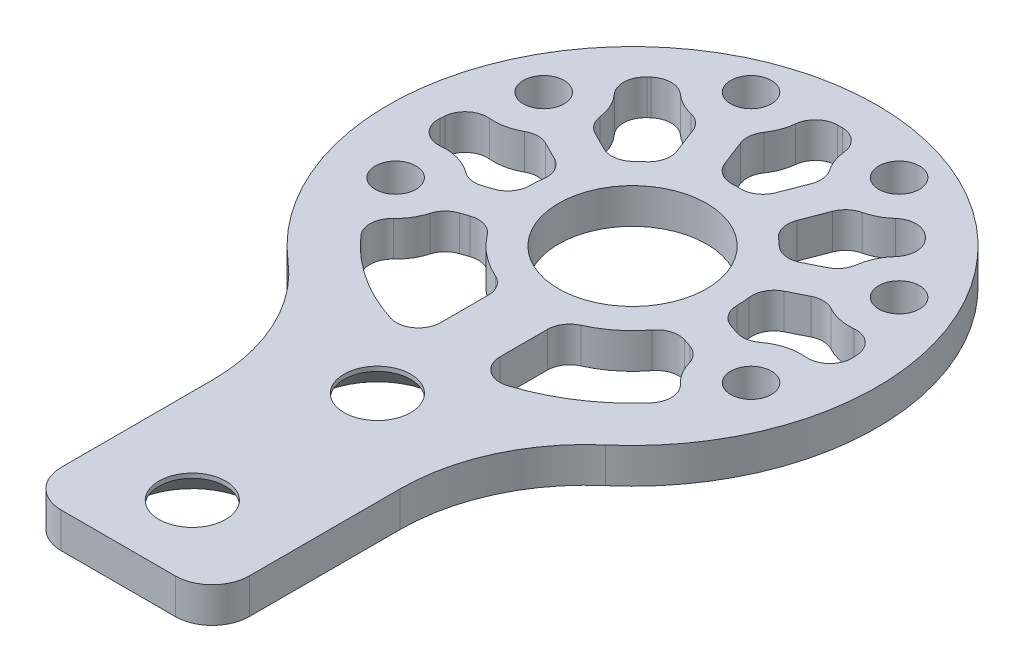
from build123d import *

# Parameters (mm, degrees)
BOSS_EXTRUDE1_DEPTH                            = 4.7625
SKETCH5_R                                      = 10
CUT_EXTRUDE1_DEPTH                             = 78.046358235
CSK_FOR_M8_FLAT_HEAD_MACHINE_SCREW1_AT_2_COUNT = 2
CSK_FOR_M8_FLAT_HEAD_MACHINE_SCREW1_AT_2_PITCH = 25
FILLET1_R                                      = 25
M5_CLEARANCE_HOLE1_D                           = 5.5
M5_CLEARANCE_HOLE1_CSINK_D                     = 5.55
M5_CLEARANCE_HOLE1_CSINK_ANGLE                 = 90
FILLET2_R                                      = 5
CUT_EXTRUDE2_DEPTH                             = 10
FILLET3_R                                      = 3


with BuildPart() as part:
    # Sketch1 → Boss-Extrude1 (new body)
    with BuildSketch(Plane(origin=(0, 0, 0), x_dir=(1, 0, 0), z_dir=(0, 1, 0))):
        with BuildLine():
            Line((-12.7, -69.458332193), (12.7, -69.458332193))
            Line((12.7, -69.458332193), (12.7, -30.458332193))
            ThreePointArc((12.7, -30.458332193), (0, 33), (-12.7, -30.458332193))
            Line((-12.7, -30.458332193), (-12.7, -69.458332193))
        make_face()
    extrude(amount=BOSS_EXTRUDE1_DEPTH)

    # Sketch5 → Cut-Extrude1 (cut, through all)
    with BuildSketch(Plane.XZ):
        with Locations(Location((0, 0, 0), (0, 0, 270))):
            Circle(SKETCH5_R)
    extrude(amount=-CUT_EXTRUDE1_DEPTH, mode=Mode.SUBTRACT)

    # Sketch8 → CSK for M8 Flat Head Machine Screw1 (revolve, cut)
    with BuildSketch(Plane(origin=(0, 0, 34.458332193), x_dir=(0, 0, -1), z_dir=(1, 0, 0))):
        Polygon((0, 0), (0, 4.7625), (4.5, 4.7625), (4.5, 4.15), (8.65, 0), align=None)
    csk_for_m8_flat_head_machine_screw1 = revolve(axis=Axis((0, -6.35, 34.458332193), (0, 1, 0)), mode=Mode.SUBTRACT)

    # CSK for M8 Flat Head Machine Screw1 at 2: CSK for M8 Flat Head Machine Screw1 ×2
    with Locations(*[(0, 0, i * CSK_FOR_M8_FLAT_HEAD_MACHINE_SCREW1_AT_2_PITCH) for i in range(1, CSK_FOR_M8_FLAT_HEAD_MACHINE_SCREW1_AT_2_COUNT)]):
        add(csk_for_m8_flat_head_machine_screw1, mode=Mode.SUBTRACT)

    # Fillet1
    fillet1_edges = [part.edges().sort_by_distance(p)[0] for p in [
        (-12.7, 2.38125, 30.458332193),
        (12.7, 2.38125, 30.458332193),
    ]]
    fillet(fillet1_edges, radius=FILLET1_R)

    # M5 Clearance Hole1 (through all)
    with Locations(Plane(origin=(0, 0, 0), x_dir=(-1, 0, 0), z_dir=(0, -1, 0))):
        with Locations((10, 26), (24, 12), (24, -8), (-10, 26), (-24, 12), (-24, -8)):
            CounterSinkHole(M5_CLEARANCE_HOLE1_D / 2, M5_CLEARANCE_HOLE1_CSINK_D / 2, counter_sink_angle=M5_CLEARANCE_HOLE1_CSINK_ANGLE)

    # Fillet2
    fillet2_edges = [part.edges().sort_by_distance(p)[0] for p in [
        (12.7, 2.38125, 69.458332193),
        (-12.7, 2.38125, 69.458332193),
    ]]
    fillet(fillet2_edges, radius=FILLET2_R)

    # Sketch12 → Cut-Extrude2 (cut)
    with BuildSketch(Plane(origin=(0, 4.7625, 0), x_dir=(1, 0, 0), z_dir=(0, 1, 0))):
        with BuildLine():
            ThreePointArc((-21.687002567, -14.341336048), (-14.041232428, -21.882499672), (-4, -25.690465157))
            Line((-4, -25.690465157), (-4, -13.416407865))
            ThreePointArc((-4, -13.416407865), (-8.799090908, -10.889260728), (-12.277521494, -6.727738548))
            Line((-12.277521494, -6.727738548), (-17.261216567, -8.388970239))
            ThreePointArc((-17.261216567, -8.388970239), (-18.583234462, -12.02754902), (-21.687002567, -14.341336048))
        make_face()
        with BuildLine():
            Line((4, -13.416407865), (4, -25.690465157))
            ThreePointArc((4, -25.690465157), (14.041232428, -21.882499672), (21.687002567, -14.341336048))
            ThreePointArc((21.687002567, -14.341336048), (18.583234462, -12.02754902), (17.261216567, -8.388970239))
            Line((17.261216567, -8.388970239), (12.277521494, -6.727738548))
            ThreePointArc((12.277521494, -6.727738548), (8.799090908, -10.889260728), (4, -13.416407865))
        make_face()
        with BuildLine():
            ThreePointArc((-27.322070756, 6.124087655), (-27.939323101, 1.842342162), (-27.889654363, -2.483380661))
            ThreePointArc((-27.889654363, -2.483380661), (-23.139993382, -1.305010185), (-18.842355397, -3.645553749))
            Line((-18.842355397, -3.645553749), (-13.858660324, -1.984322058))
            ThreePointArc((-13.858660324, -1.984322058), (-13.964778923, 0.992446281), (-13.438748254, 3.924289155))
            Line((-13.438748254, 3.924289155), (-19.510004032, 6.959917044))
            ThreePointArc((-19.510004032, 6.959917044), (-23.281901805, 5.288306102), (-27.322070756, 6.124087655))
        make_face()
        with BuildLine():
            ThreePointArc((18.842355397, -3.645553749), (23.139993382, -1.305010185), (27.889654363, -2.483380661))
            ThreePointArc((27.889654363, -2.483380661), (27.939323101, 1.842342162), (27.322070756, 6.124087655))
            ThreePointArc((27.322070756, 6.124087655), (23.281901805, 5.288306102), (19.510004032, 6.959917044))
            Line((19.510004032, 6.959917044), (13.438748254, 3.924289155))
            ThreePointArc((13.438748254, 3.924289155), (13.964778923, 0.992446281), (13.858660324, -1.984322058))
            Line((13.858660324, -1.984322058), (18.842355397, -3.645553749))
        make_face()
        with BuildLine():
            ThreePointArc((-16.026551151, 22.959739942), (-18.811750404, 20.739287518), (-21.292512577, 18.183204012))
            ThreePointArc((-21.292512577, 18.183204012), (-18.199785965, 15.452537783), (-17.273936054, 11.432052999))
            Line((-17.273936054, 11.432052999), (-11.202680276, 8.39642511))
            ThreePointArc((-11.202680276, 8.39642511), (-9.410644447, 10.365315774), (-7.278292689, 11.959366853))
            Line((-7.278292689, 11.959366853), (-10.082576639, 19.250505123))
            ThreePointArc((-10.082576639, 19.250505123), (-13.573508965, 20.27352345), (-16.026551151, 22.959739942))
        make_face()
        with BuildLine():
            ThreePointArc((17.273936054, 11.432052999), (18.199785965, 15.452537783), (21.292512577, 18.183204012))
            ThreePointArc((21.292512577, 18.183204012), (18.811750404, 20.739287518), (16.026551151, 22.959739942))
            ThreePointArc((16.026551151, 22.959739942), (13.573508965, 20.27352345), (10.082576639, 19.250505123))
            Line((10.082576639, 19.250505123), (7.278292689, 11.959366853))
            ThreePointArc((7.278292689, 11.959366853), (9.410644447, 10.365315774), (11.202680276, 8.39642511))
            Line((11.202680276, 8.39642511), (17.273936054, 11.432052999))
        make_face()
        with BuildLine():
            ThreePointArc((3.489396014, 27.781722687), (0, 28), (-3.489396014, 27.781722687))
            ThreePointArc((-3.489396014, 27.781722687), (-3.510168853, 24.144038878), (-5.415848608, 21.045400519))
            Line((-5.415848608, 21.045400519), (-2.611564658, 13.75426225))
            ThreePointArc((-2.611564658, 13.75426225), (0, 14), (2.611564658, 13.75426225))
            Line((2.611564658, 13.75426225), (5.415848608, 21.045400519))
            ThreePointArc((5.415848608, 21.045400519), (3.510168853, 24.144038878), (3.489396014, 27.781722687))
        make_face()
    extrude(amount=-CUT_EXTRUDE2_DEPTH, mode=Mode.SUBTRACT)

    # Fillet3
    fillet3_edges = [part.edges().sort_by_distance(p)[0] for p in [
        (4, 2.38125, 25.690465157),
        (4, 2.38125, 13.416407865),
        (12.277521494, 2.38125, 6.727738548),
        (17.261216567, 2.38125, 8.388970239),
        (21.687002567, 2.38125, 14.341336048),
        (-21.687002567, 2.38125, 14.341336048),
        (-17.261216567, 2.38125, 8.388970239),
        (-12.277521494, 2.38125, 6.727738548),
        (-4, 2.38125, 13.416407865),
        (-4, 2.38125, 25.690465157),
        (13.858660324, 2.38125, 1.984322058),
        (13.438748254, 2.38125, -3.924289155),
        (19.510004032, 2.38125, -6.959917044),
        (27.322070756, 2.38125, -6.124087655),
        (27.889654363, 2.38125, 2.483380661),
        (18.842355397, 2.38125, 3.645553749),
        (-7.278292689, 2.38125, -11.959366853),
        (-11.202680276, 2.38125, -8.39642511),
        (-17.273936054, 2.38125, -11.432052999),
        (-21.292512577, 2.38125, -18.183204012),
        (-16.026551151, 2.38125, -22.959739942),
        (-10.082576639, 2.38125, -19.250505123),
        (11.202680276, 2.38125, -8.39642511),
        (7.278292689, 2.38125, -11.959366853),
        (10.082576639, 2.38125, -19.250505123),
        (16.026551151, 2.38125, -22.959739942),
        (21.292512577, 2.38125, -18.183204012),
        (17.273936054, 2.38125, -11.432052999),
        (2.611564658, 2.38125, -13.75426225),
        (-2.611564658, 2.38125, -13.75426225),
        (-5.415848608, 2.38125, -21.045400519),
        (-3.489396014, 2.38125, -27.781722687),
        (3.489396014, 2.38125, -27.781722687),
        (5.415848608, 2.38125, -21.045400519),
        (-13.438748254, 2.38125, -3.924289155),
        (-13.858660324, 2.38125, 1.984322058),
        (-18.842355397, 2.38125, 3.645553749),
        (-27.889654363, 2.38125, 2.483380661),
        (-27.322070756, 2.38125, -6.124087655),
        (-19.510004032, 2.38125, -6.959917044),
    ]]
    fillet(fillet3_edges, radius=FILLET3_R)


solid = part.part
